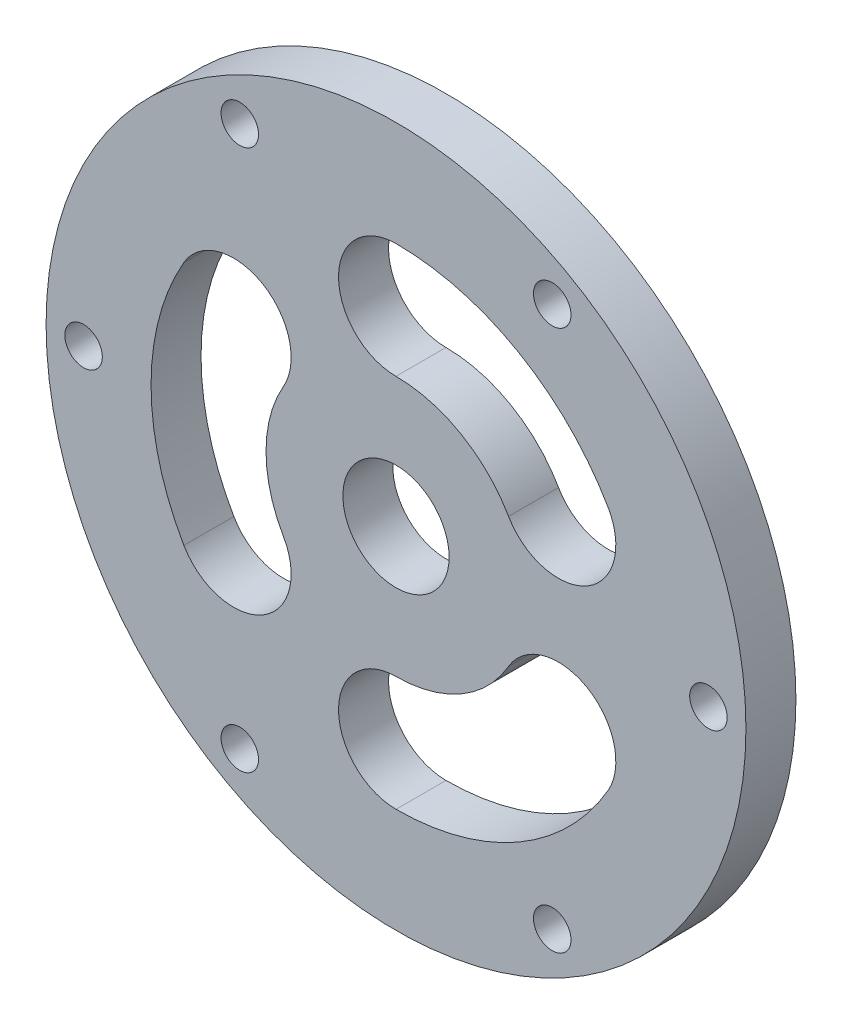
from build123d import *

# Parameters (mm, degrees)
SKETCH_1_R      = 28
SKETCH_1_R_2    = 4.25
SKETCH_1_R_3    = 1.5
EXTRUDE_1_DEPTH = 4


with BuildPart() as part:
    # 草图1 → 凸台-拉伸1 (new body)
    with BuildSketch(Plane.XY):
        Circle(SKETCH_1_R)
        Circle(SKETCH_1_R_2, mode=Mode.SUBTRACT)
        with Locations((12.5, 21.650635095)):
            Circle(SKETCH_1_R_3, mode=Mode.SUBTRACT)
        with Locations((25, 0)):
            Circle(SKETCH_1_R_3, mode=Mode.SUBTRACT)
        with Locations((12.5, -21.650635095)):
            Circle(SKETCH_1_R_3, mode=Mode.SUBTRACT)
        with Locations((-12.5, -21.650635095)):
            Circle(SKETCH_1_R_3, mode=Mode.SUBTRACT)
        with Locations((-25, 0)):
            Circle(SKETCH_1_R_3, mode=Mode.SUBTRACT)
        with Locations((-12.5, 21.650635095)):
            Circle(SKETCH_1_R_3, mode=Mode.SUBTRACT)
        with BuildLine():
            ThreePointArc((9.006664199, -5.2), (15.290381057, -3.516283143), (16.974097914, -9.8))
            ThreePointArc((16.974097914, -9.8), (9.8, -16.974097914), (0, -19.6))
            ThreePointArc((0, -19.6), (-4.6, -15), (0, -10.4))
            ThreePointArc((0, -10.4), (5.2, -9.006664199), (9.006664199, -5.2))
        make_face(mode=Mode.SUBTRACT)
        with BuildLine():
            ThreePointArc((-9.006664199, 5.2), (-10.4, 0), (-9.006664199, -5.2))
            ThreePointArc((-9.006664199, -5.2), (-10.690381057, -11.483716857), (-16.974097914, -9.8))
            ThreePointArc((-16.974097914, -9.8), (-19.6, 0), (-16.974097914, 9.8))
            ThreePointArc((-16.974097914, 9.8), (-10.690381057, 11.483716857), (-9.006664199, 5.2))
        make_face(mode=Mode.SUBTRACT)
        with BuildLine():
            ThreePointArc((9.006664199, 5.2), (5.2, 9.006664199), (0, 10.4))
            ThreePointArc((0, 10.4), (-4.6, 15), (0, 19.6))
            ThreePointArc((0, 19.6), (9.8, 16.974097914), (16.974097914, 9.8))
            ThreePointArc((16.974097914, 9.8), (15.290381057, 3.516283143), (9.006664199, 5.2))
        make_face(mode=Mode.SUBTRACT)
    extrude(amount=EXTRUDE_1_DEPTH)


solid = part.part
